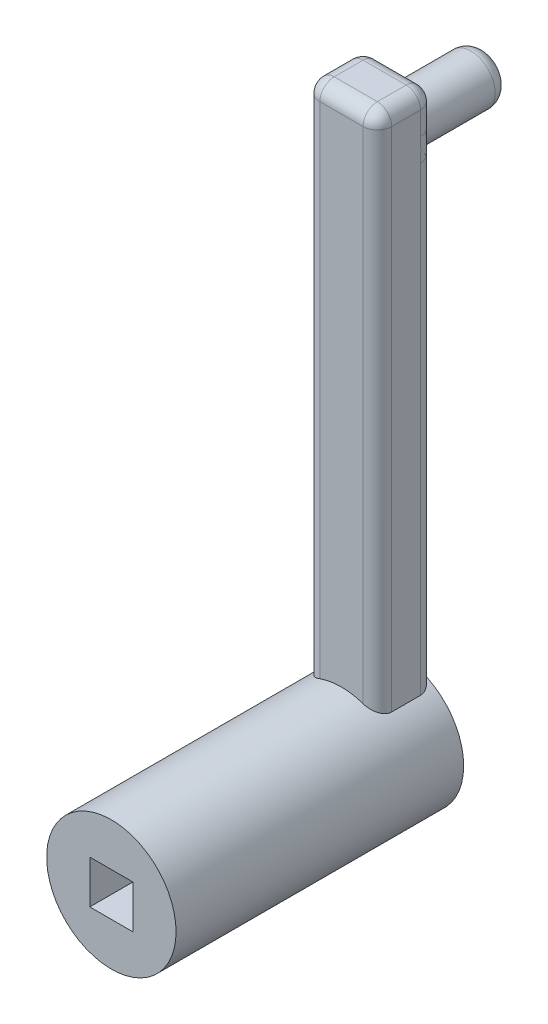
from build123d import *

# Parameters (mm, degrees)
SKETCH1_R           = 5.715
BOSS_EXTRUDE1_DEPTH = 25.4
SKETCH2_W           = 5.08
SKETCH2_H           = 50.8
BOSS_EXTRUDE2_DEPTH = 3.175
SKETCH3_R           = 2.159
BOSS_EXTRUDE3_DEPTH = 7.62
FILLET1_R           = 1.27
SKETCH4_W           = 3.81
SKETCH4_H           = 3.81
CUT_EXTRUDE1_DEPTH  = 7.62


with BuildPart() as part:
    # Sketch1 → Boss-Extrude1 (new body)
    with BuildSketch(Plane.XY):
        Circle(SKETCH1_R)
    extrude(amount=-BOSS_EXTRUDE1_DEPTH)

    # Sketch2 → Boss-Extrude2 (add, symmetric)
    with BuildSketch(Plane(origin=(0, 0, 0), x_dir=(0, 0, -1), z_dir=(1, 0, 0))):
        with Locations((22.86, 25.4)):
            Rectangle(SKETCH2_W, SKETCH2_H)
    extrude(amount=BOSS_EXTRUDE2_DEPTH, both=True)

    # Sketch3 → Boss-Extrude3 (add)
    with BuildSketch(Plane(origin=(0, 0, -25.4), x_dir=(-1, 0, 0), z_dir=(0, 0, -1))):
        with Locations(Location((0, 46.482, 0), (0, 0, 180))):
            Circle(SKETCH3_R)
    extrude(amount=BOSS_EXTRUDE3_DEPTH)

    # Fillet1
    fillet1_edges = [part.edges().sort_by_distance(p)[0] for p in [
        (-3.175, 27.775952441, -25.4),
        (-3.175, 50.8, -22.86),
        (0, 50.8, -25.4),
        (0, 50.8, -20.32),
        (-3.175, 27.775952441, -20.32),
        (3.175, 27.775952441, -20.32),
        (3.175, 27.775952441, -25.4),
        (3.175, 50.8, -22.86),
        (-2.159, 46.482, -33.02),
    ]]
    fillet(fillet1_edges, radius=FILLET1_R)

    # Sketch4 → Cut-Extrude1 (cut)
    with BuildSketch(Plane.XY):
        Rectangle(SKETCH4_W, SKETCH4_H)
    extrude(amount=-CUT_EXTRUDE1_DEPTH, mode=Mode.SUBTRACT)


solid = part.part
